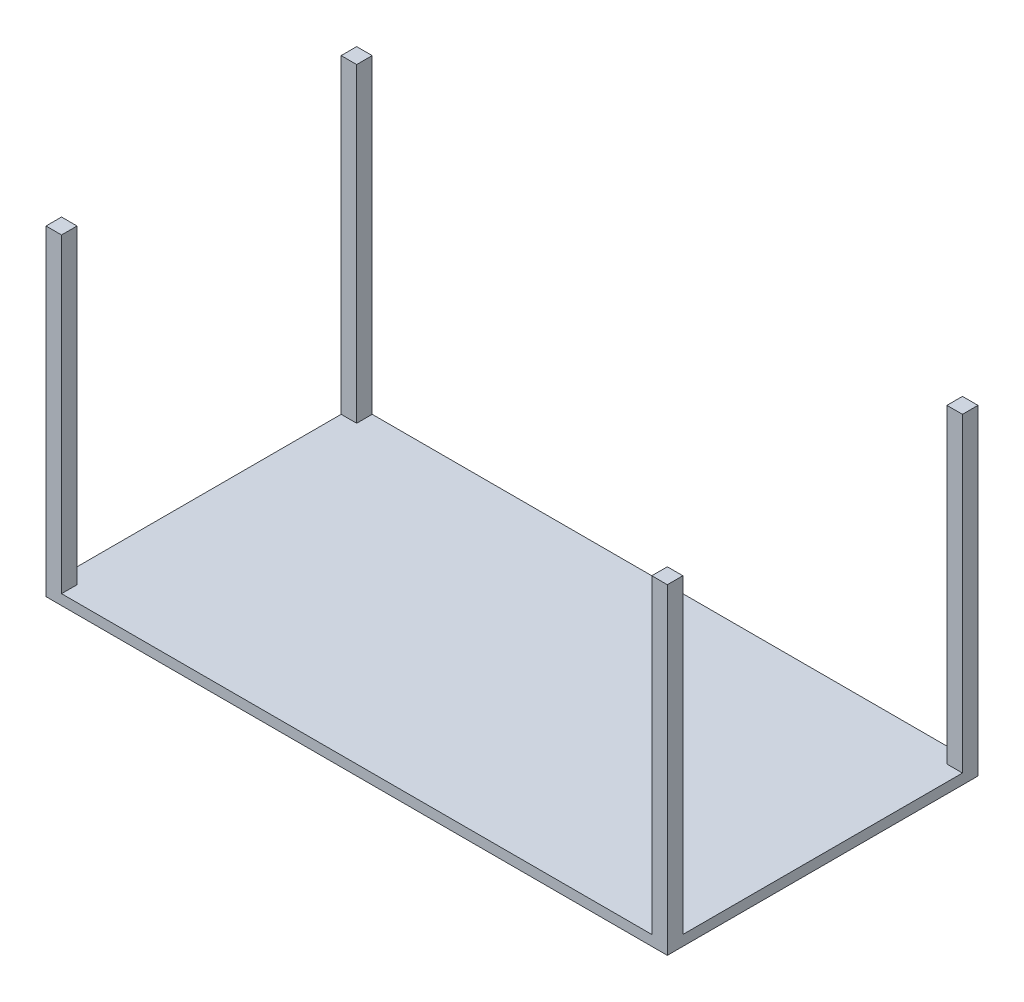
from build123d import *

# Parameters (mm, degrees)
SKETCH1_W           = 1524
SKETCH1_H           = 762
BOSS_EXTRUDE1_DEPTH = 25.4
SKETCH2_W           = 38.1
SKETCH2_H           = 38.1
BOSS_EXTRUDE2_DEPTH = 762


with BuildPart() as part:
    # Sketch1 → Boss-Extrude1 (new body)
    with BuildSketch(Plane(origin=(0, 0, 0), x_dir=(1, 0, 0), z_dir=(0, 1, 0))):
        Rectangle(SKETCH1_W, SKETCH1_H)
    extrude(amount=BOSS_EXTRUDE1_DEPTH)

    # Sketch2 → Boss-Extrude2 (add)
    with BuildSketch(Plane(origin=(0, 25.4, 0), x_dir=(1, 0, 0), z_dir=(0, 1, 0))):
        with Locations((-742.95, 361.95)):
            Rectangle(SKETCH2_W, SKETCH2_H)
        with Locations((-742.95, -361.95)):
            Rectangle(SKETCH2_W, SKETCH2_H)
        with Locations((742.95, 361.95)):
            Rectangle(SKETCH2_W, SKETCH2_H)
        with Locations((742.95, -361.95)):
            Rectangle(SKETCH2_W, SKETCH2_H)
    extrude(amount=BOSS_EXTRUDE2_DEPTH)


solid = part.part
